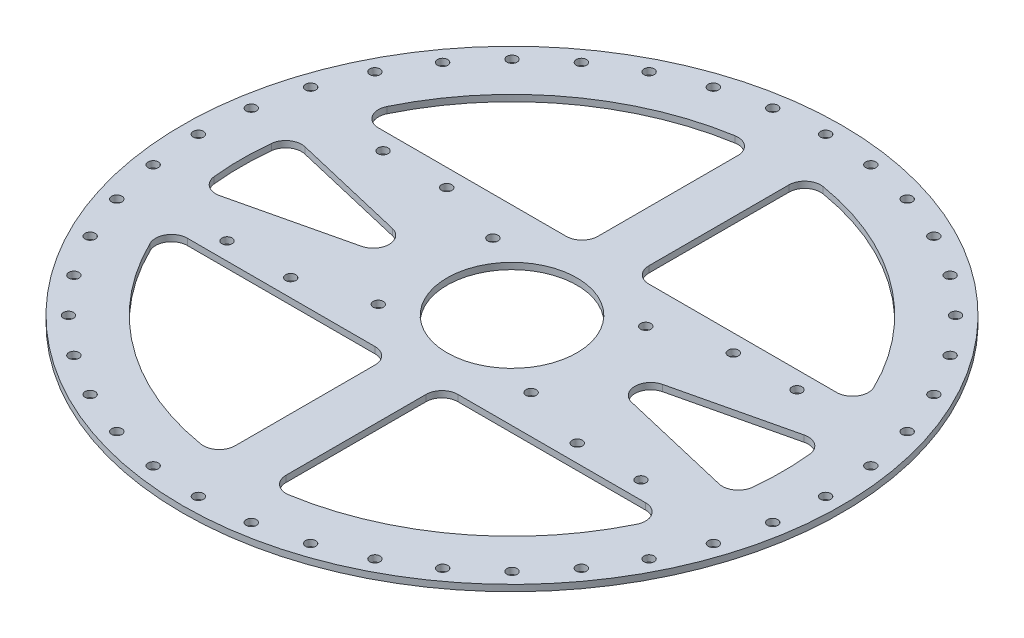
from build123d import *

# Parameters (mm, degrees)
SKETCH_1_R          = 103.5
SKETCH_1_R_2        = 1.6
EXTRUDE_1_DEPTH     = 2
SKETCH_2_R          = 1.6
CUT_EXTRUDE_1_DEPTH = 147.384766967
SKETCH_3_W          = 8
SKETCH_3_H          = 8
CUT_EXTRUDE_2_DEPTH = 10
CUT_EXTRUDE_START   = -10
CUT_EXTRUDE_3_DEPTH = 10
FILLET_1_R          = 5


with BuildPart() as part:
    # 草图1 → 凸台-拉伸1 (new body)
    with BuildSketch(Plane(origin=(0, 0, 0), x_dir=(1, 0, 0), z_dir=(0, 1, 0))):
        with Locations(Location((0, 0, 0), (0, 0, 270))):
            Circle(SKETCH_1_R)
        with Locations(Location((-24, -18, 0), (0, 0, 270))):
            Circle(SKETCH_1_R_2, mode=Mode.SUBTRACT)
        with Locations(Location((24, -18, 0), (0, 0, 270))):
            Circle(SKETCH_1_R_2, mode=Mode.SUBTRACT)
        with Locations(Location((24, 18, 0), (0, 0, 270))):
            Circle(SKETCH_1_R_2, mode=Mode.SUBTRACT)
        with Locations(Location((-24, 18, 0), (0, 0, 270))):
            Circle(SKETCH_1_R_2, mode=Mode.SUBTRACT)
    extrude(amount=EXTRUDE_1_DEPTH)

    # 草图2 → 切除-拉伸1 (cut, through all)
    with BuildSketch(Plane(origin=(0, 2, 0), x_dir=(1, 0, 0), z_dir=(0, 1, 0))):
        with Locations(Location((-45, 24.5, 0), (0, 0, 270))):
            Circle(SKETCH_2_R)
        with Locations(Location((-65, 24.5, 0), (0, 0, 270))):
            Circle(SKETCH_2_R)
        with Locations(Location((-65, -24.5, 0), (0, 0, 270))):
            Circle(SKETCH_2_R)
        with Locations(Location((-45, -24.5, 0), (0, 0, 270))):
            Circle(SKETCH_2_R)
        with Locations(Location((45, -24.5, 0), (0, 0, 270))):
            Circle(SKETCH_2_R)
        with Locations(Location((65, -24.5, 0), (0, 0, 270))):
            Circle(SKETCH_2_R)
        with Locations(Location((45, 24.5, 0), (0, 0, 270))):
            Circle(SKETCH_2_R)
        with Locations(Location((65, 24.5, 0), (0, 0, 270))):
            Circle(SKETCH_2_R)
        with Locations(Location((0, 98.5, 0), (0, 0, 270))):
            Circle(SKETCH_2_R)
        with Locations(Location((15.408794806, 97.287301549, 0), (0, 0, 270))):
            Circle(SKETCH_2_R)
        with Locations(Location((30.438173946, 93.679066855, 0), (0, 0, 270))):
            Circle(SKETCH_2_R)
        with Locations(Location((44.718064224, 87.764142633, 0), (0, 0, 270))):
            Circle(SKETCH_2_R)
        with Locations(Location((57.896847351, 79.688173946, 0), (0, 0, 270))):
            Circle(SKETCH_2_R)
        with Locations(Location((69.650017947, 69.650017947, 0), (0, 0, 270))):
            Circle(SKETCH_2_R)
        with Locations(Location((79.688173946, 57.896847351, 0), (0, 0, 270))):
            Circle(SKETCH_2_R)
        with Locations(Location((87.764142633, 44.718064224, 0), (0, 0, 270))):
            Circle(SKETCH_2_R)
        with Locations(Location((93.679066855, 30.438173946, 0), (0, 0, 270))):
            Circle(SKETCH_2_R)
        with Locations(Location((97.287301549, 15.408794806, 0), (0, 0, 270))):
            Circle(SKETCH_2_R)
        with Locations(Location((98.5, 0, 0), (0, 0, 270))):
            Circle(SKETCH_2_R)
        with Locations(Location((97.287301549, -15.408794806, 0), (0, 0, 270))):
            Circle(SKETCH_2_R)
        with Locations(Location((93.679066855, -30.438173946, 0), (0, 0, 270))):
            Circle(SKETCH_2_R)
        with Locations(Location((87.764142633, -44.718064224, 0), (0, 0, 270))):
            Circle(SKETCH_2_R)
        with Locations(Location((79.688173946, -57.896847351, 0), (0, 0, 270))):
            Circle(SKETCH_2_R)
        with Locations(Location((69.650017947, -69.650017947, 0), (0, 0, 270))):
            Circle(SKETCH_2_R)
        with Locations(Location((57.896847351, -79.688173946, 0), (0, 0, 270))):
            Circle(SKETCH_2_R)
        with Locations(Location((44.718064224, -87.764142633, 0), (0, 0, 270))):
            Circle(SKETCH_2_R)
        with Locations(Location((30.438173946, -93.679066855, 0), (0, 0, 270))):
            Circle(SKETCH_2_R)
        with Locations(Location((15.408794806, -97.287301549, 0), (0, 0, 270))):
            Circle(SKETCH_2_R)
        with Locations(Location((0, -98.5, 0), (0, 0, 270))):
            Circle(SKETCH_2_R)
        with Locations(Location((-15.408794806, -97.287301549, 0), (0, 0, 270))):
            Circle(SKETCH_2_R)
        with Locations(Location((-30.438173946, -93.679066855, 0), (0, 0, 270))):
            Circle(SKETCH_2_R)
        with Locations(Location((-44.718064224, -87.764142633, 0), (0, 0, 270))):
            Circle(SKETCH_2_R)
        with Locations(Location((-57.896847351, -79.688173946, 0), (0, 0, 270))):
            Circle(SKETCH_2_R)
        with Locations(Location((-69.650017947, -69.650017947, 0), (0, 0, 270))):
            Circle(SKETCH_2_R)
        with Locations(Location((-79.688173946, -57.896847351, 0), (0, 0, 270))):
            Circle(SKETCH_2_R)
        with Locations(Location((-87.764142633, -44.718064224, 0), (0, 0, 270))):
            Circle(SKETCH_2_R)
        with Locations(Location((-93.679066855, -30.438173946, 0), (0, 0, 270))):
            Circle(SKETCH_2_R)
        with Locations(Location((-97.287301549, -15.408794806, 0), (0, 0, 270))):
            Circle(SKETCH_2_R)
        with Locations(Location((-98.5, 0, 0), (0, 0, 270))):
            Circle(SKETCH_2_R)
        with Locations(Location((-97.287301549, 15.408794806, 0), (0, 0, 270))):
            Circle(SKETCH_2_R)
        with Locations(Location((-93.679066855, 30.438173946, 0), (0, 0, 270))):
            Circle(SKETCH_2_R)
        with Locations(Location((-87.764142633, 44.718064224, 0), (0, 0, 270))):
            Circle(SKETCH_2_R)
        with Locations(Location((-79.688173946, 57.896847351, 0), (0, 0, 270))):
            Circle(SKETCH_2_R)
        with Locations(Location((-69.650017947, 69.650017947, 0), (0, 0, 270))):
            Circle(SKETCH_2_R)
        with Locations(Location((-57.896847351, 79.688173946, 0), (0, 0, 270))):
            Circle(SKETCH_2_R)
        with Locations(Location((-44.718064224, 87.764142633, 0), (0, 0, 270))):
            Circle(SKETCH_2_R)
        with Locations(Location((-30.438173946, 93.679066855, 0), (0, 0, 270))):
            Circle(SKETCH_2_R)
        with Locations(Location((-15.408794806, 97.287301549, 0), (0, 0, 270))):
            Circle(SKETCH_2_R)
    extrude(amount=-CUT_EXTRUDE_1_DEPTH, mode=Mode.SUBTRACT)

    # 草图3 → 切除-拉伸2 (cut)
    with BuildSketch(Plane(origin=(0, 2, 0), x_dir=(1, 0, 0), z_dir=(0, 1, 0))):
        with BuildLine():
            ThreePointArc((-79.529868603, -30), (-51.587586632, -67.555317374), (-8, -84.622691992))
            Line((-8, -84.622691992), (-8, -30))
            Line((-8, -30), (-79.529868603, -30))
        make_face()
        with BuildLine():
            Line((8, -30), (8, -84.622691992))
            ThreePointArc((8, -84.622691992), (51.587586632, -67.555317374), (79.529868603, -30))
            Line((79.529868603, -30), (8, -30))
        make_face()
        with BuildLine():
            Line((8, 30), (79.529868603, 30))
            ThreePointArc((79.529868603, 30), (51.587586632, 67.555317374), (8, 84.622691992))
            Line((8, 84.622691992), (8, 30))
        make_face()
        with BuildLine():
            ThreePointArc((-8, 84.622691992), (-51.587586632, 67.555317374), (-79.529868603, 30))
            Line((-79.529868603, 30), (-8, 30))
            Line((-8, 30), (-8, 84.622691992))
        make_face()
        with BuildLine():
            Line((-18.765926569, 8), (-8, 8))
            Line((-8, 8), (-8, 18.765926569))
            ThreePointArc((-8, 18.765926569), (-12.590175955, 16.051400856), (-16.320000071, 12.239999905))
            ThreePointArc((-16.320000071, 12.239999905), (-17.670595968, 10.19362733), (-18.765926569, 8))
        make_face()
        with BuildLine():
            Line((-20.4, 0), (-8, 0))
            Line((-8, 0), (-8, 8))
            Line((-8, 8), (-18.765926569, 8))
            ThreePointArc((-18.765926569, 8), (-19.987307247, 4.082590966), (-20.4, 0))
        make_face()
        with BuildLine():
            Line((-18.765926569, -8), (-8, -8))
            Line((-8, -8), (-8, 0))
            Line((-8, 0), (-20.4, 0))
            ThreePointArc((-20.4, 0), (-19.987307247, -4.082590966), (-18.765926569, -8))
        make_face()
        with BuildLine():
            ThreePointArc((-16.320000071, -12.239999905), (-12.590175955, -16.051400856), (-8, -18.765926569))
            Line((-8, -18.765926569), (-8, -8))
            Line((-8, -8), (-18.765926569, -8))
            ThreePointArc((-18.765926569, -8), (-17.670595968, -10.19362733), (-16.320000071, -12.239999905))
        make_face()
        with BuildLine():
            ThreePointArc((-8, -18.765926569), (-4.082590966, -19.987307247), (0, -20.4))
            Line((0, -20.4), (0, -8))
            Line((0, -8), (-8, -8))
            Line((-8, -8), (-8, -18.765926569))
        make_face()
        with BuildLine():
            Line((0, -8), (0, -20.4))
            ThreePointArc((0, -20.4), (4.082590966, -19.987307247), (8, -18.765926569))
            Line((8, -18.765926569), (8, -8))
            Line((8, -8), (0, -8))
        make_face()
        with Locations((4, -4)):
            Rectangle(SKETCH_3_W, SKETCH_3_H)
        with Locations((-4, -4)):
            Rectangle(SKETCH_3_W, SKETCH_3_H)
        with Locations((-4, 4)):
            Rectangle(SKETCH_3_W, SKETCH_3_H)
        with Locations((4, 4)):
            Rectangle(SKETCH_3_W, SKETCH_3_H)
        with BuildLine():
            Line((0, 20.4), (0, 8))
            Line((0, 8), (8, 8))
            Line((8, 8), (8, 18.765926569))
            ThreePointArc((8, 18.765926569), (4.082590966, 19.987307247), (0, 20.4))
        make_face()
        with BuildLine():
            Line((-8, 8), (0, 8))
            Line((0, 8), (0, 20.4))
            ThreePointArc((0, 20.4), (-4.082590966, 19.987307247), (-8, 18.765926569))
            Line((-8, 18.765926569), (-8, 8))
        make_face()
        with BuildLine():
            Line((8, 18.765926569), (8, 8))
            Line((8, 8), (18.765926569, 8))
            ThreePointArc((18.765926569, 8), (17.670595876, 10.193627488), (16.319999852, 12.240000197))
            ThreePointArc((16.319999852, 12.240000197), (12.590175811, 16.051400968), (8, 18.765926569))
        make_face()
        with BuildLine():
            Line((8, 8), (8, 0))
            Line((8, 0), (20.4, 0))
            ThreePointArc((20.4, 0), (19.987307247, 4.082590966), (18.765926569, 8))
            Line((18.765926569, 8), (8, 8))
        make_face()
        with BuildLine():
            Line((8, 0), (8, -8))
            Line((8, -8), (18.765926569, -8))
            ThreePointArc((18.765926569, -8), (19.987307247, -4.082590966), (20.4, 0))
            Line((20.4, 0), (8, 0))
        make_face()
        with BuildLine():
            Line((8, -8), (8, -18.765926569))
            ThreePointArc((8, -18.765926569), (12.59017607, -16.051400765), (16.320000248, -12.23999967))
            ThreePointArc((16.320000248, -12.23999967), (17.670596041, -10.193627203), (18.765926569, -8))
            Line((18.765926569, -8), (8, -8))
        make_face()
    extrude(amount=-CUT_EXTRUDE_2_DEPTH, mode=Mode.SUBTRACT)

    # 草图4 → 切除-拉伸3 (cut)
    with BuildSketch(Plane.XZ.offset(CUT_EXTRUDE_START)):
        with BuildLine():
            ThreePointArc((-83.7368024, 14.599586429), (-85, 0), (-83.7368024, -14.599586429))
            Line((-83.7368024, -14.599586429), (-21.794871795, 0))
            Line((-21.794871795, 0), (-83.7368024, 14.599586429))
        make_face()
        with BuildLine():
            Line((83.7368024, 14.599586429), (21.794871795, 0))
            Line((21.794871795, 0), (83.7368024, -14.599586429))
            ThreePointArc((83.7368024, -14.599586429), (84.683611767, -7.327066126), (85, 0))
            ThreePointArc((85, 0), (84.683611767, 7.327066126), (83.7368024, 14.599586429))
        make_face()
    extrude(amount=CUT_EXTRUDE_3_DEPTH, mode=Mode.SUBTRACT)

    # 圆角1
    fillet_1_edges = [part.edges().sort_by_distance(p)[0] for p in [
        (8, 1, 84.622691992),
        (8, 1, 30),
        (79.529868603, 1, 30),
        (79.529868603, 1, -30),
        (8, 1, -30),
        (8, 1, -84.622691992),
        (-8, 1, -84.622691992),
        (-8, 1, -30),
        (-79.529868603, 1, -30),
        (-79.529868603, 1, 30),
        (-8, 1, 30),
        (-8, 1, 84.622691992),
        (-83.7368024, 1, 14.599586429),
        (-21.794871795, 1, 0),
        (-83.7368024, 1, -14.599586429),
        (83.7368024, 1, -14.599586429),
        (21.794871795, 1, 0),
        (83.7368024, 1, 14.599586429),
    ]]
    fillet(fillet_1_edges, radius=FILLET_1_R)


solid = part.part
